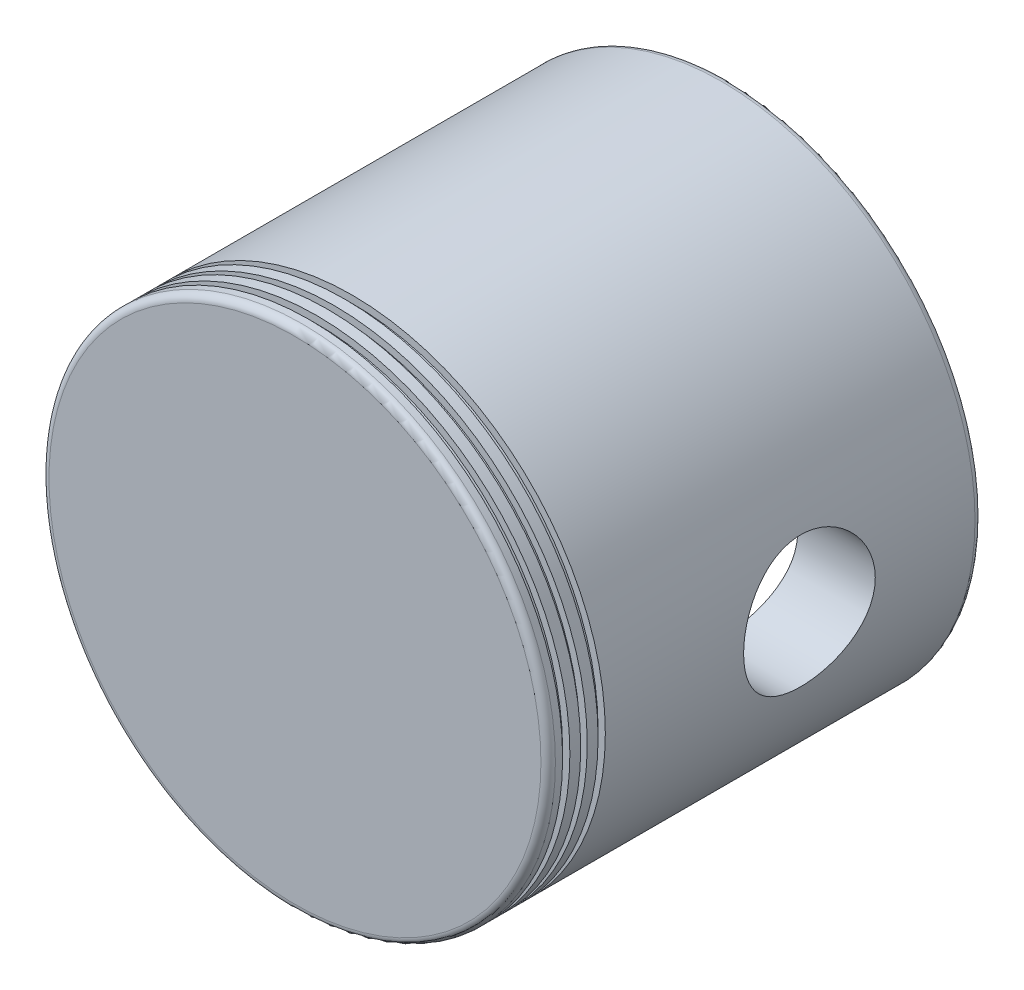
from build123d import *

# Parameters (mm, degrees)
CUT_EXTRUDE1_START = 70
CUT_EXTRUDE1_DEPTH = 70
SKETCH3_R          = 9.1
CUT_EXTRUDE2_DEPTH = 50


with BuildPart() as part:
    # Sketch1 → Revolve1 (revolve)
    with BuildSketch(Plane(origin=(0, 0, 0), x_dir=(0, 0, -1), z_dir=(1, 0, 0)), mode=Mode.PRIVATE) as revolve1_sk:
        with BuildLine():
            Line((0, 34), (0, 0))
            Line((0, 0), (10.130985, 0))
            Line((10.130985, 0), (10.130985, 29.814294))
            ThreePointArc((10.130985, 29.814294), (10.423878, 30.521401), (11.130985, 30.814294))
            Line((11.130985, 30.814294), (22.615883, 30.814294))
            ThreePointArc((22.615883, 30.814294), (23.32299, 30.521401), (23.615883, 29.814294))
            Line((23.615883, 29.814294), (23.615883, 25.256822))
            ThreePointArc((23.615883, 25.256822), (23.908776, 24.549715), (24.615883, 24.256822))
            Line((24.615883, 24.256822), (47.615883, 24.256822))
            ThreePointArc((47.615883, 24.256822), (48.32299, 24.549715), (48.615883, 25.256822))
            Line((48.615883, 25.256822), (48.615883, 29.814294))
            ThreePointArc((48.615883, 29.814294), (48.908776, 30.521401), (49.615883, 30.814294))
            Line((49.615883, 30.814294), (56.202357, 30.814294))
            ThreePointArc((56.202357, 30.814294), (56.477131, 30.852786), (56.730753, 30.965297))
            Line((56.730753, 30.965297), (59.528397, 32.706485))
            ThreePointArc((59.528397, 32.706485), (59.874184, 33.069888), (60, 33.555483))
            Line((60, 33.555483), (60, 34))
            ThreePointArc((60, 34), (59.707107, 34.707107), (59, 35))
            Line((59, 35), (7.900539, 35))
            Line((7.900539, 35), (7.900539, 34))
            Line((7.900539, 34), (6.900539, 34))
            Line((6.900539, 34), (6.900539, 35))
            Line((6.900539, 35), (5.400539, 35))
            Line((5.400539, 35), (5.400539, 34))
            Line((5.400539, 34), (4.5, 34))
            Line((4.5, 34), (4.5, 35))
            Line((4.5, 35), (3, 35))
            Line((3, 35), (3, 34))
            Line((3, 34), (2, 34))
            Line((2, 34), (2, 35))
            Line((2, 35), (1, 35))
            ThreePointArc((1, 35), (0.292893, 34.707107), (0, 34))
        make_face()
    revolve(revolve1_sk.sketch.rotate(Axis((0, 0, 0), (0, 0, -1)), 90), axis=Axis((0, 0, 0), (0, 0, -1)))

    # Sketch2 → Cut-Extrude1 (cut)
    with BuildSketch(Plane(origin=(0, 0, -10.130985), x_dir=(-1, 0, 0), z_dir=(0, 0, -1)).offset(CUT_EXTRUDE1_START)):
        with BuildLine():
            Line((-28.381697, 12), (28.381697, 12))
            ThreePointArc((28.381697, 12), (0, 30.814294), (-28.381697, 12))
        make_face()
        with BuildLine():
            Line((-28.381697, -12), (28.381697, -12))
            ThreePointArc((28.381697, -12), (0, -30.814294), (-28.381697, -12))
        make_face()
    extrude(amount=-CUT_EXTRUDE1_DEPTH, mode=Mode.SUBTRACT)

    # Sketch3 → Cut-Extrude2 (cut, symmetric)
    with BuildSketch(Plane(origin=(0, 0, 0), x_dir=(0, 0, -1), z_dir=(1, 0, 0))):
        with Locations((36.115883, 0)):
            Circle(SKETCH3_R)
    extrude(amount=CUT_EXTRUDE2_DEPTH, both=True, mode=Mode.SUBTRACT)


solid = part.part
